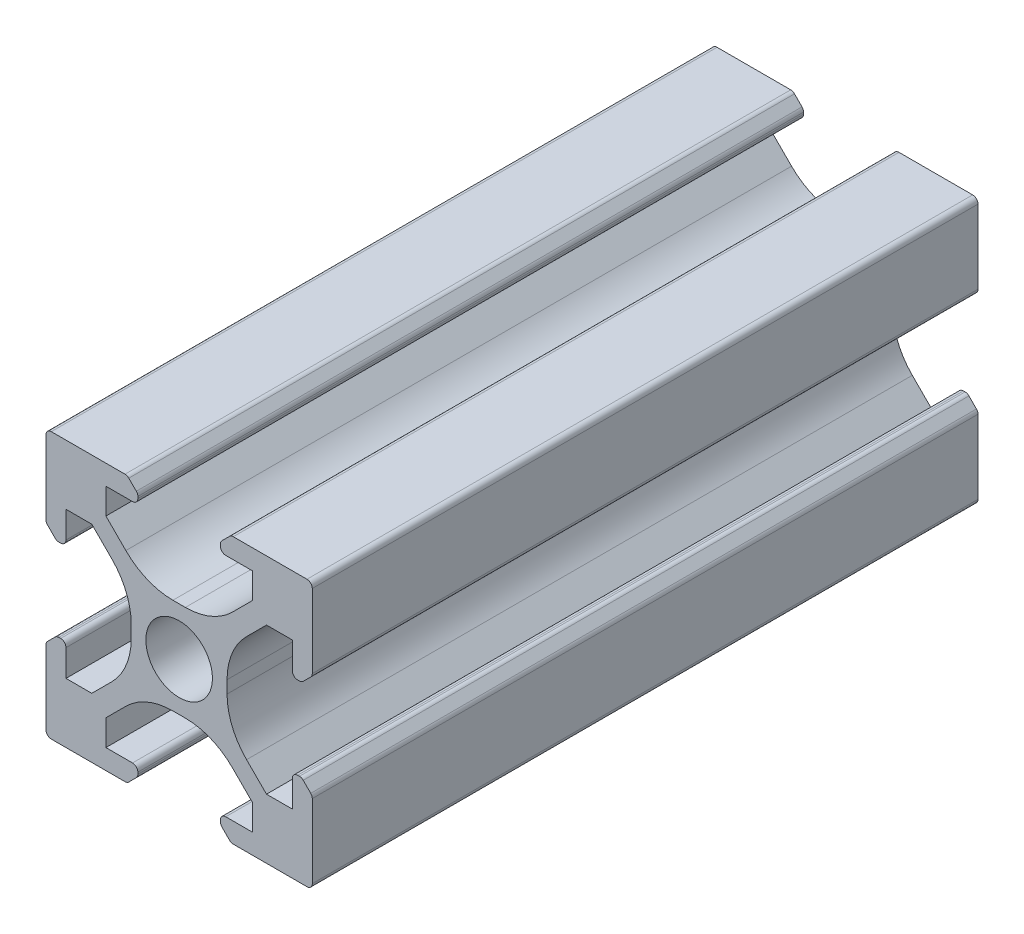
from build123d import *

# Parameters (mm, degrees)
RESSALTO_EXTRUS_O1_DEPTH = 50
PADR_OCIRCULAR1_COUNT    = 4
FILETE1_R                = 0.4


with BuildPart() as part:
    # Esboço1 → Ressalto-extrusão1 (new body)
    with BuildSketch(Plane.XY):
        with BuildLine():
            ThreePointArc((-9.317157288, 3.217157288), (-9.187387948, 3.130448187), (-9.034314575, 3.1))
            Line((-9.034314575, 3.1), (-8.9, 3.1))
            ThreePointArc((-8.9, 3.1), (-8.617157288, 3.217157288), (-8.5, 3.5))
            Line((-8.5, 3.5), (-8.5, 5.5))
            Line((-8.5, 5.5), (-6.560660172, 5.5))
            Line((-6.560660172, 5.5), (-5.064466094, 4.003805922))
            ThreePointArc((-5.064466094, 4.003805922), (-3.980602337, 2.381689178), (-3.6, 0.468272016))
            Line((-3.6, 0.468272016), (-3.6, 0))
            Line((-3.6, 0), (-2.5, 0))
            ThreePointArc((-2.5, 0), (-1.767766953, 1.767766953), (0, 2.5))
            Line((0, 2.5), (0, 3.6))
            Line((0, 3.6), (-0.468272016, 3.6))
            ThreePointArc((-0.468272016, 3.6), (-2.381689178, 3.980602337), (-4.003805922, 5.064466094))
            Line((-4.003805922, 5.064466094), (-5.5, 6.560660172))
            Line((-5.5, 6.560660172), (-5.5, 8.5))
            Line((-5.5, 8.5), (-3.5, 8.5))
            ThreePointArc((-3.5, 8.5), (-3.217157288, 8.617157288), (-3.1, 8.9))
            Line((-3.1, 8.9), (-3.1, 9.034314575))
            ThreePointArc((-3.1, 9.034314575), (-3.130448187, 9.187387948), (-3.217157288, 9.317157288))
            Line((-3.217157288, 9.317157288), (-3.782842712, 9.882842712))
            ThreePointArc((-3.782842712, 9.882842712), (-3.912612052, 9.969551813), (-4.065685425, 10))
            Line((-4.065685425, 10), (-10, 10))
            Line((-10, 10), (-10, 4.065685425))
            ThreePointArc((-10, 4.065685425), (-9.969551813, 3.912612052), (-9.882842712, 3.782842712))
            Line((-9.882842712, 3.782842712), (-9.317157288, 3.217157288))
        make_face()
    ressalto_extrus_o1 = extrude(amount=RESSALTO_EXTRUS_O1_DEPTH)

    # PadrãoCircular1: Ressalto-extrusão1 ×4 about axis
    padr_ocircular1_axis = Axis((0, 0, 0), (0, 0, 1))
    for i in range(1, PADR_OCIRCULAR1_COUNT):
        add(ressalto_extrus_o1.rotate(padr_ocircular1_axis, i * 360 / PADR_OCIRCULAR1_COUNT))

    # Filete1
    filete1_edges = [part.edges().sort_by_distance(p)[0] for p in [
        (10, -10, 25),
        (10, 10, 25),
        (-10, 10, 25),
        (-10, -10, 25),
    ]]
    fillet(filete1_edges, radius=FILETE1_R)


solid = part.part
